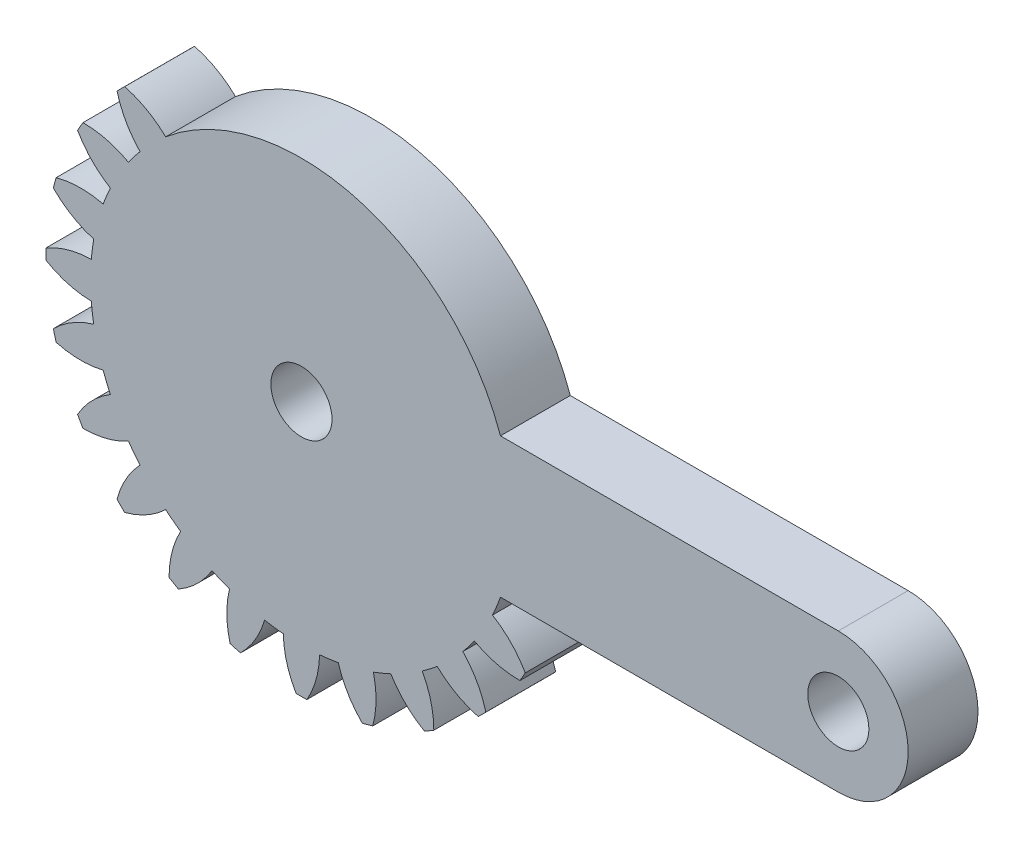
from build123d import *

# Parameters (mm, degrees)
SKETCH1_R           = 1.75
BOSS_EXTRUDE3_DEPTH = 4


with BuildPart() as part:
    # Sketch1 → Boss-Extrude3 (new body)
    with BuildSketch(Plane.XY):
        with BuildLine():
            ThreePointArc((11.398526221, 4), (3.187763399, 11.651805204), (-7.774744082, 9.245526186))
            ThreePointArc((-7.774744082, 9.245526186), (-8.865739978, 10.052419077), (-10.123446462, 10.561852666))
            ThreePointArc((-10.123446462, 10.561852666), (-10.344972209, 10.344972209), (-10.561852666, 10.123446462))
            ThreePointArc((-10.561852666, 10.123446462), (-10.052419077, 8.865739978), (-9.245526186, 7.774744082))
            ThreePointArc((-9.245526186, 7.774744082), (-9.583708351, 7.353838062), (-9.90274436, 6.918240682))
            ThreePointArc((-9.90274436, 6.918240682), (-11.16540472, 7.415268848), (-12.51210701, 7.581825517))
            ThreePointArc((-12.51210701, 7.581825517), (-12.669951657, 7.315), (-12.82210701, 7.044889767))
            ThreePointArc((-12.82210701, 7.044889767), (-12.004513558, 5.961889707), (-10.94274436, 5.116907842))
            ThreePointArc((-10.94274436, 5.116907842), (-11.160464753, 4.622815863), (-11.355888976, 4.119488508))
            ThreePointArc((-11.355888976, 4.119488508), (-12.704165582, 4.272780301), (-14.048088143, 4.085109489))
            ThreePointArc((-14.048088143, 4.085109489), (-14.131494839, 3.78652263), (-14.208555951, 3.486235477))
            ThreePointArc((-14.208555951, 3.486235477), (-13.138520279, 2.651746506), (-11.89423259, 2.110362789))
            ThreePointArc((-11.89423259, 2.110362789), (-11.976653925, 1.576756402), (-12.035148524, 1.04))
            ThreePointArc((-12.035148524, 1.04), (-13.377158555, 0.839108838), (-14.626715284, 0.31))
            ThreePointArc((-14.626715284, 0.31), (-14.63, 0), (-14.626715284, -0.31))
            ThreePointArc((-14.626715284, -0.31), (-13.377158555, -0.839108838), (-12.035148524, -1.04))
            ThreePointArc((-12.035148524, -1.04), (-11.976653925, -1.576756402), (-11.89423259, -2.110362789))
            ThreePointArc((-11.89423259, -2.110362789), (-13.138520279, -2.651746506), (-14.208555951, -3.486235477))
            ThreePointArc((-14.208555951, -3.486235477), (-14.131494839, -3.78652263), (-14.048088143, -4.085109489))
            ThreePointArc((-14.048088143, -4.085109489), (-12.704165582, -4.272780301), (-11.355888976, -4.119488508))
            ThreePointArc((-11.355888976, -4.119488508), (-11.160464753, -4.622815863), (-10.94274436, -5.116907842))
            ThreePointArc((-10.94274436, -5.116907842), (-12.004513558, -5.961889707), (-12.82210701, -7.044889767))
            ThreePointArc((-12.82210701, -7.044889767), (-12.669951657, -7.315), (-12.51210701, -7.581825517))
            ThreePointArc((-12.51210701, -7.581825517), (-11.16540472, -7.415268848), (-9.90274436, -6.918240682))
            ThreePointArc((-9.90274436, -6.918240682), (-9.583708351, -7.353838062), (-9.245526186, -7.774744082))
            ThreePointArc((-9.245526186, -7.774744082), (-10.052419077, -8.865739978), (-10.561852666, -10.123446462))
            ThreePointArc((-10.561852666, -10.123446462), (-10.344972209, -10.344972209), (-10.123446462, -10.561852666))
            ThreePointArc((-10.123446462, -10.561852666), (-8.865739978, -10.052419077), (-7.774744082, -9.245526186))
            ThreePointArc((-7.774744082, -9.245526186), (-7.353838062, -9.583708351), (-6.918240682, -9.90274436))
            ThreePointArc((-6.918240682, -9.90274436), (-7.415268848, -11.16540472), (-7.581825517, -12.51210701))
            ThreePointArc((-7.581825517, -12.51210701), (-7.315, -12.669951657), (-7.044889767, -12.82210701))
            ThreePointArc((-7.044889767, -12.82210701), (-5.961889707, -12.004513558), (-5.116907842, -10.94274436))
            ThreePointArc((-5.116907842, -10.94274436), (-4.622815863, -11.160464753), (-4.119488508, -11.355888976))
            ThreePointArc((-4.119488508, -11.355888976), (-4.272780301, -12.704165582), (-4.085109489, -14.048088143))
            ThreePointArc((-4.085109489, -14.048088143), (-3.78652263, -14.131494839), (-3.486235477, -14.208555951))
            ThreePointArc((-3.486235477, -14.208555951), (-2.651746506, -13.138520279), (-2.110362789, -11.89423259))
            ThreePointArc((-2.110362789, -11.89423259), (-1.576756402, -11.976653925), (-1.04, -12.035148524))
            ThreePointArc((-1.04, -12.035148524), (-0.839108838, -13.377158555), (-0.31, -14.626715284))
            ThreePointArc((-0.31, -14.626715284), (0, -14.63), (0.31, -14.626715284))
            ThreePointArc((0.31, -14.626715284), (0.839108838, -13.377158555), (1.04, -12.035148524))
            ThreePointArc((1.04, -12.035148524), (1.576756402, -11.976653925), (2.110362789, -11.89423259))
            ThreePointArc((2.110362789, -11.89423259), (2.651746506, -13.138520279), (3.486235477, -14.208555951))
            ThreePointArc((3.486235477, -14.208555951), (3.78652263, -14.131494839), (4.085109489, -14.048088143))
            ThreePointArc((4.085109489, -14.048088143), (4.272780301, -12.704165582), (4.119488508, -11.355888976))
            ThreePointArc((4.119488508, -11.355888976), (4.622815863, -11.160464753), (5.116907842, -10.94274436))
            ThreePointArc((5.116907842, -10.94274436), (5.961889707, -12.004513558), (7.044889767, -12.82210701))
            ThreePointArc((7.044889767, -12.82210701), (7.315, -12.669951657), (7.581825517, -12.51210701))
            ThreePointArc((7.581825517, -12.51210701), (7.415268848, -11.16540472), (6.918240682, -9.90274436))
            ThreePointArc((6.918240682, -9.90274436), (7.353838062, -9.583708351), (7.774744082, -9.245526186))
            ThreePointArc((7.774744082, -9.245526186), (8.865739978, -10.052419077), (10.123446462, -10.561852666))
            ThreePointArc((10.123446462, -10.561852666), (10.344972209, -10.344972209), (10.561852666, -10.123446462))
            ThreePointArc((10.561852666, -10.123446462), (10.052419077, -8.865739978), (9.245526186, -7.774744082))
            ThreePointArc((9.245526186, -7.774744082), (9.583708351, -7.353838062), (9.90274436, -6.918240682))
            ThreePointArc((9.90274436, -6.918240682), (11.16540472, -7.415268848), (12.51210701, -7.581825517))
            ThreePointArc((12.51210701, -7.581825517), (12.669951657, -7.315), (12.82210701, -7.044889767))
            ThreePointArc((12.82210701, -7.044889767), (12.004513558, -5.961889707), (10.94274436, -5.116907842))
            ThreePointArc((10.94274436, -5.116907842), (11.184585981, -4.564146845), (11.398526221, -4))
            Line((11.398526221, -4), (30.75, -4))
            ThreePointArc((30.75, -4), (34.75, 0), (30.75, 4))
            Line((30.75, 4), (11.398526221, 4))
        make_face()
        Circle(SKETCH1_R, mode=Mode.SUBTRACT)
        with Locations((30.75, 0)):
            Circle(SKETCH1_R, mode=Mode.SUBTRACT)
    extrude(amount=BOSS_EXTRUDE3_DEPTH)


solid = part.part
